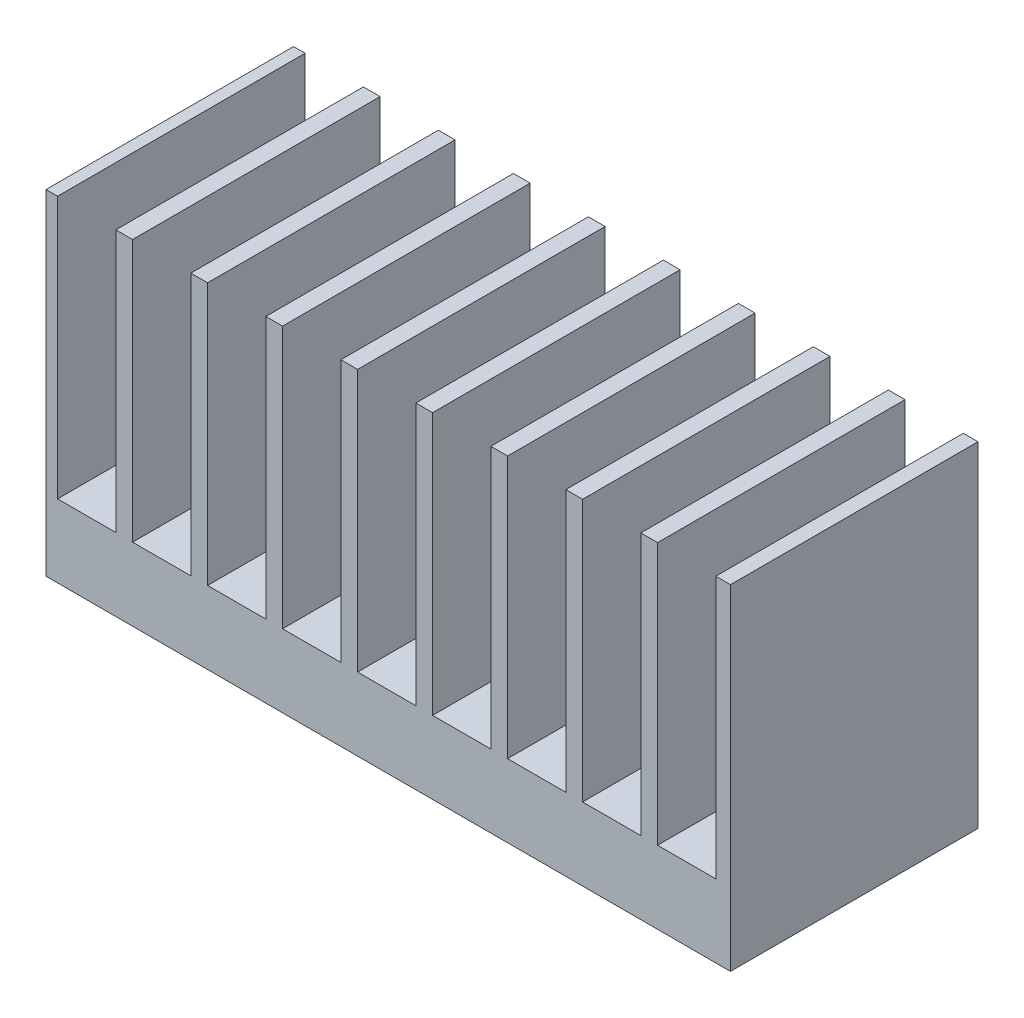
from build123d import *

# Parameters (mm, degrees)
SKETCH1_W           = 47
SKETCH1_H           = 17
BOSS_EXTRUDE1_DEPTH = 23
SKETCH2_W           = 4
SKETCH2_H           = 18
CUT_EXTRUDE1_DEPTH  = 38.016888038
SKETCH3_R           = 2
CUT_EXTRUDE2_DEPTH  = 8


with BuildPart() as part:
    # Sketch1 → Boss-Extrude1 (new body)
    with BuildSketch(Plane(origin=(0, 0, 0), x_dir=(1, 0, 0), z_dir=(0, 1, 0))):
        Rectangle(SKETCH1_W, SKETCH1_H)
    extrude(amount=BOSS_EXTRUDE1_DEPTH)

    # Sketch2 → Cut-Extrude1 (cut, through all)
    with BuildSketch(Plane.XY.offset(8.5)):
        with Locations((-20.70480001, 14)):
            Rectangle(SKETCH2_W, SKETCH2_H)
        with Locations((-15.55480001, 14)):
            Rectangle(SKETCH2_W, SKETCH2_H)
        with Locations((-10.40480001, 14)):
            Rectangle(SKETCH2_W, SKETCH2_H)
        with Locations((-5.25480001, 14)):
            Rectangle(SKETCH2_W, SKETCH2_H)
        with Locations((-0.10480001, 14)):
            Rectangle(SKETCH2_W, SKETCH2_H)
        with Locations((5.04519999, 14)):
            Rectangle(SKETCH2_W, SKETCH2_H)
        with Locations((10.19519999, 14)):
            Rectangle(SKETCH2_W, SKETCH2_H)
        with Locations((15.34519999, 14)):
            Rectangle(SKETCH2_W, SKETCH2_H)
        with Locations((20.49519999, 14)):
            Rectangle(SKETCH2_W, SKETCH2_H)
    extrude(amount=-CUT_EXTRUDE1_DEPTH, mode=Mode.SUBTRACT)

    # Sketch3 → Cut-Extrude2 (cut)
    with BuildSketch(Plane.XZ):
        with Locations(Location((-20.600691388, 0, 0), (0, 0, 270))):
            Circle(SKETCH3_R)
        with Locations(Location((20.600691388, 0, 0), (0, 0, 341.307868808))):
            Circle(SKETCH3_R)
    extrude(amount=-CUT_EXTRUDE2_DEPTH, mode=Mode.SUBTRACT)


solid = part.part
